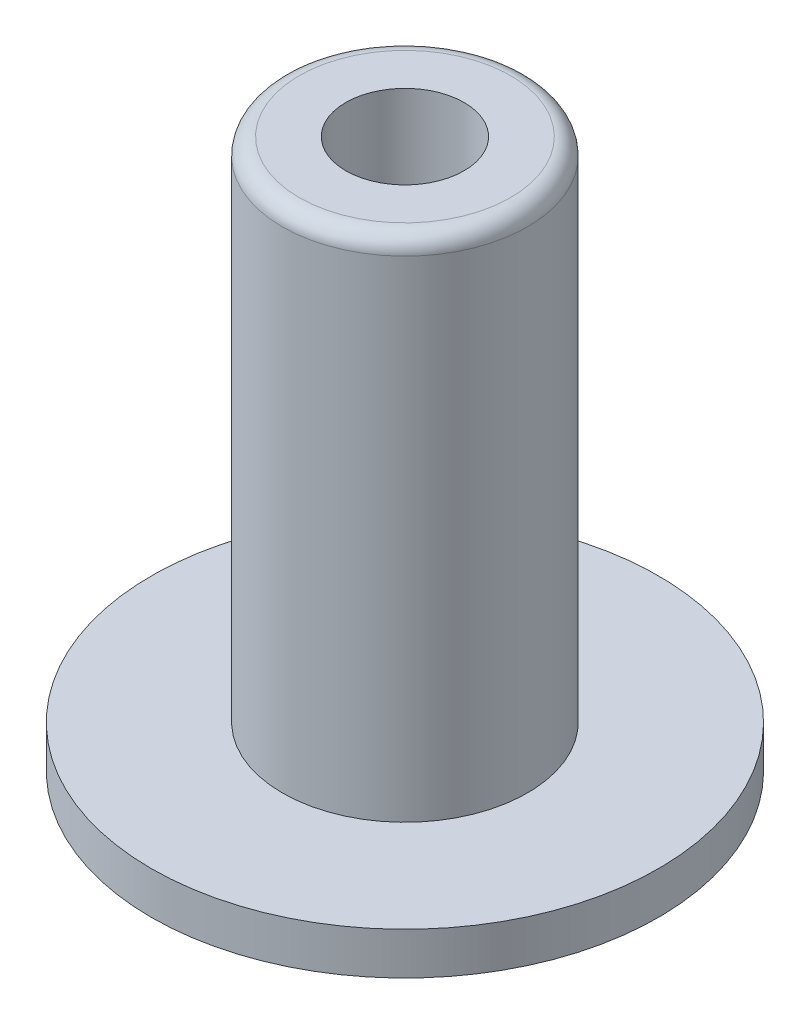
from build123d import *
from build123d.topology import SkipClean

# Parameters (mm, degrees)
SKETCH1_R           = 7.25
SKETCH1_R_2         = 3.5
BOSS_EXTRUDE1_DEPTH = 30
BOSS_EXTRUDE2_START = 5
SKETCH2_R           = 10
SKETCH2_R_2         = 3.5
BOSS_EXTRUDE2_DEPTH = 5
BOSS_EXTRUDE3_START = -2.5
SKETCH3_R           = 15
SKETCH3_R_2         = 3.5
BOSS_EXTRUDE3_DEPTH = 2.5
FILLET1_R           = 1


with BuildPart() as part:
    # Sketch1 → Boss-Extrude1 (new body)
    with BuildSketch(Plane(origin=(0, 0, 0), x_dir=(1, 0, 0), z_dir=(0, 1, 0))):
        with Locations(Location((0, 0, 0), (0, 0, 270))):
            Circle(SKETCH1_R)
        with Locations(Location((0, 0, 0), (0, 0, 270))):
            Circle(SKETCH1_R_2, mode=Mode.SUBTRACT)
    extrude(amount=BOSS_EXTRUDE1_DEPTH)

    # Sketch2 → Boss-Extrude2 (add)
    with SkipClean():  # the faces are left unmerged after this step: merging them gives an invalid solid
        with BuildSketch(Plane.XZ.offset(BOSS_EXTRUDE2_START)):
            with Locations(Location((0, 0, 0), (0, 0, 270))):
                Circle(SKETCH2_R)
            with Locations(Location((0, 0, 0), (0, 0, 270))):
                Circle(SKETCH2_R_2, mode=Mode.SUBTRACT)
        extrude(amount=-BOSS_EXTRUDE2_DEPTH)

    # Sketch3 → Boss-Extrude3 (add)
    with SkipClean():  # the faces are left unmerged after this step: merging them gives an invalid solid
        with BuildSketch(Plane(origin=(0, 0, 0), x_dir=(1, 0, 0), z_dir=(0, 1, 0)).offset(BOSS_EXTRUDE3_START)):
            with Locations(Location((0, 0, 0), (0, 0, 270))):
                Circle(SKETCH3_R)
            with Locations(Location((0, 0, 0), (0, 0, 90))):
                Circle(SKETCH3_R_2, mode=Mode.SUBTRACT)
        extrude(amount=BOSS_EXTRUDE3_DEPTH)

    # Fillet1
    fillet1_edges = [part.edges().sort_by_distance(p)[0] for p in [
        (0, -5, 10),
        (0, -5, 3.5),
        (0, -2.5, 10),
        (0, 30, -7.25),
    ]]
    fillet(fillet1_edges, radius=FILLET1_R)


solid = part.part
